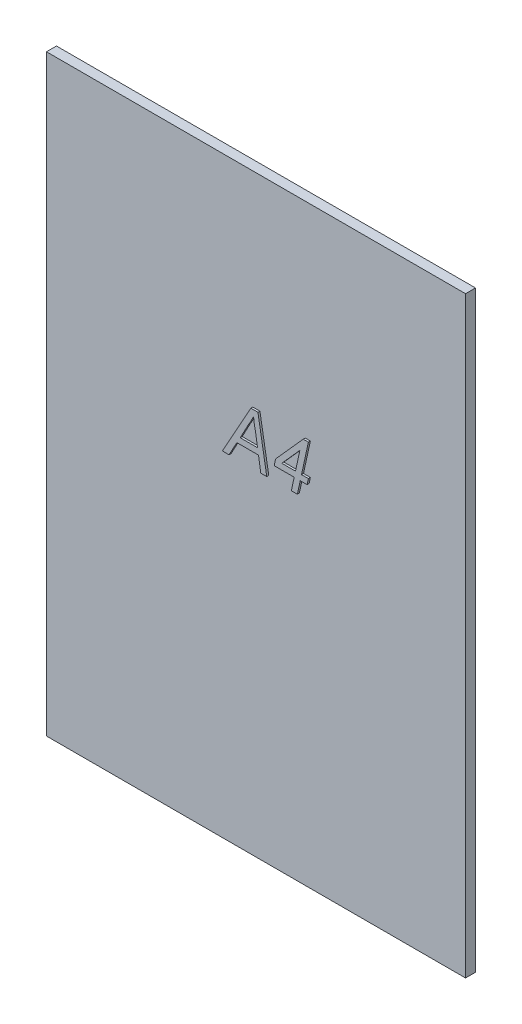
from build123d import *

# Parameters (mm, degrees)
SKETCH_1_W        = 210
SKETCH_1_H        = 297
EXTRUDE_1_DEPTH   = 2.5
EXTRUDE_4_DEPTH   = 1
EXTRUDE_4_2_DEPTH = 1


with BuildPart() as part:
    # Эскиз1 → Бобышка-Вытянуть1 (new, symmetric)
    with BuildSketch(Plane.XY):
        Rectangle(SKETCH_1_W, SKETCH_1_H)
    extrude(amount=EXTRUDE_1_DEPTH, both=True)


with BuildPart() as body_2:
    # Эскиз3 → Бобышка-Вытянуть4 (new body)
    with BuildSketch(Plane.XY.offset(2.5)):
        Polygon((-15.83342859, 20.32176214), (-1.576996147, 46.004948989), (1.957528966, 46.004948989), (6.387261314, 20.32176214), (3.392947462, 20.32176214), (2.235351901, 27.565737918), (-8.599742551, 27.565737918), (-12.514987982, 20.32176214), align=None)
        with BuildLine():
            Line((-6.907080597, 30.529182554), (1.767168807, 30.529182554))
            Line((1.767168807, 30.529182554), (0.779353929, 36.713315285))
            add(Edge.make_bspline(
                [(0.779353929, 36.713315285), (0.712533382, 37.023394355), (0.582081342, 37.628753776), (0.418647768, 38.521085999), (0.251500229, 39.369449286), (0.124242409, 40.180667833), (-0.001907587, 40.950882353), (-0.086357291, 41.68329044), (-0.176984948, 42.374744734), (-0.212021321, 42.823512834), (-0.229040427, 43.041504353)],
                knots=[0, 0, 0, 0, 1.187075157, 2.317496411, 3.39507795, 4.42283965, 5.390522706, 6.315610667, 7.18179882, 8, 8, 8, 8], degree=3))
            add(Edge.make_bspline(
                [(-0.229040427, 43.041504353), (-0.402495517, 42.662669814), (-0.768210165, 41.863930844), (-1.41336508, 40.634068736), (-2.16421726, 39.304320997), (-2.71499697, 38.392537906), (-3.002124904, 37.917214669)],
                knots=[0, 0, 0, 0, 0.85739934, 1.807750339, 2.857154497, 4, 4, 4, 4], degree=3))
            Line((-3.002124904, 37.917214669), (-6.907080597, 30.529182554))
        make_face(mode=Mode.SUBTRACT)
    extrude(amount=EXTRUDE_4_DEPTH)


with BuildPart() as body_3:
    # Эскиз3 → Extrude 4 2 (new body)
    with BuildSketch(Plane.XY.offset(2.5)):
        Polygon((18.704078084, 20.32176214), (20.139496579, 26.907194665), (10.143015801, 26.907194665), (10.801559053, 30.18962119), (24.630967356, 45.675677363), (27.24456089, 45.675677363), (23.802643422, 29.870639302), (27.265140367, 29.870639302), (26.606597114, 26.907194665), (23.159534777, 26.907194665), (21.724116281, 20.32176214), align=None)
        Polygon((20.782605224, 29.870639302), (22.989754094, 40.016321286), (13.929639503, 29.870639302), align=None, mode=Mode.SUBTRACT)
    extrude(amount=EXTRUDE_4_2_DEPTH)


solid = Compound([part.part, body_2.part, body_3.part])
